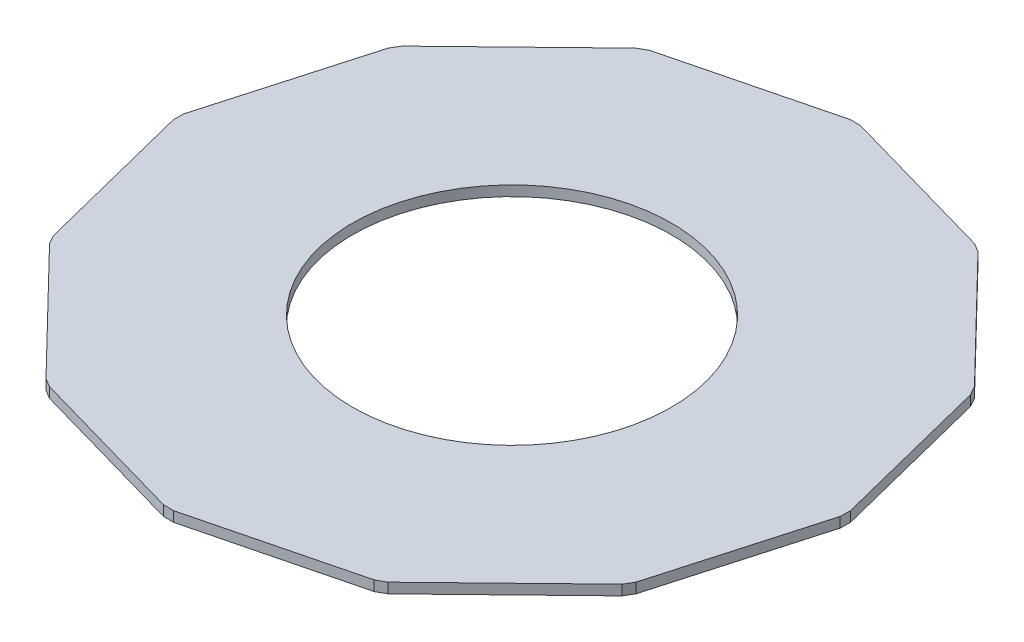
from build123d import *

# Parameters (mm, degrees)
SKETCH1_R           = 47.116713319
BOSS_EXTRUDE1_DEPTH = 3


with BuildPart() as part:
    # Sketch1 → Boss-Extrude1 (new body)
    with BuildSketch(Plane(origin=(0, 0, 0), x_dir=(1, 0, 0), z_dir=(0, 1, 0))):
        Polygon((-88.068159647, -47.370869281), (-99.999999495, 0.010045682), (-99.954698159, 3.009703627), (-86.597517101, 50.008699563), (-85.05845602, 52.583828878), (-49.991299932, 86.607562782), (-47.370869281, 88.068159647), (0.010045682, 99.999999495), (3.009703627, 99.954698159), (50.008699563, 86.597517101), (52.583828878, 85.05845602), (86.607562782, 49.991299932), (88.068159647, 47.370869281), (99.999999495, -0.010045682), (99.954698159, -3.009703627), (86.597517101, -50.008699563), (85.05845602, -52.583828878), (49.991299932, -86.607562782), (47.370869281, -88.068159647), (-0.010045682, -99.999999495), (-3.009703627, -99.954698159), (-50.008699563, -86.597517101), (-52.583828878, -85.05845602), (-86.607562782, -49.991299932), align=None)
        with Locations(Location((0, 0, 0), (0, 0, 270))):
            Circle(SKETCH1_R, mode=Mode.SUBTRACT)
    extrude(amount=BOSS_EXTRUDE1_DEPTH)


solid = part.part
